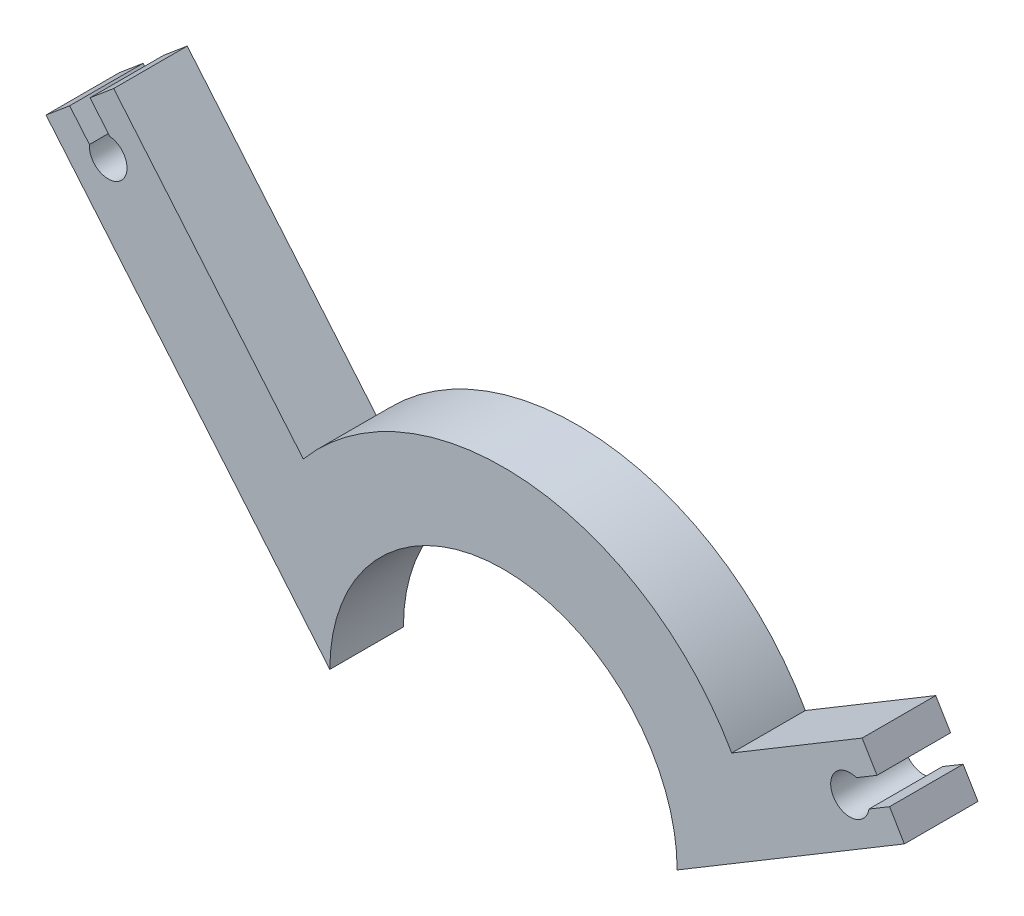
from build123d import *

# Parameters (mm, degrees)
BOSS_EXTRUDE1_DEPTH = 1.5875


with BuildPart() as part:
    # Sketch2 → Boss-Extrude1 (new body)
    with BuildSketch(Plane.XY):
        with BuildLine():
            Line((-3.7465, 0), (-9.869051982, 7.296573321))
            Line((-9.869051982, 7.296573321), (-9.35953146, 7.724111803))
            Line((-9.35953146, 7.724111803), (-8.931992977, 7.214591281))
            ThreePointArc((-8.931992977, 7.214591281), (-8.265910567, 6.867850725), (-8.491719358, 7.584024712))
            Line((-8.491719358, 7.584024712), (-8.919257841, 8.093545235))
            Line((-8.919257841, 8.093545235), (-8.409737318, 8.521083717))
            Line((-8.409737318, 8.521083717), (-4.318588224, 3.645442086))
            ThreePointArc((-4.318588224, 3.645442086), (0.530437252, 5.626552103), (4.923786313, 2.774126996))
            Line((4.923786313, 2.774126996), (7.736674427, 4.459657279))
            Line((7.736674427, 4.459657279), (8.057589571, 3.924099773))
            Line((8.057589571, 3.924099773), (7.612727117, 3.657530643))
            ThreePointArc((7.612727117, 3.657530643), (7.116813389, 3.053887496), (7.882987176, 3.206508602))
            Line((7.882987176, 3.206508602), (8.32784963, 3.473077733))
            Line((8.32784963, 3.473077733), (8.648764774, 2.937520227))
            Line((8.648764774, 2.937520227), (3.7465, 0))
            ThreePointArc((3.7465, 0), (0, 3.7465), (-3.7465, 0))
        make_face()
    extrude(amount=BOSS_EXTRUDE1_DEPTH)


solid = part.part
